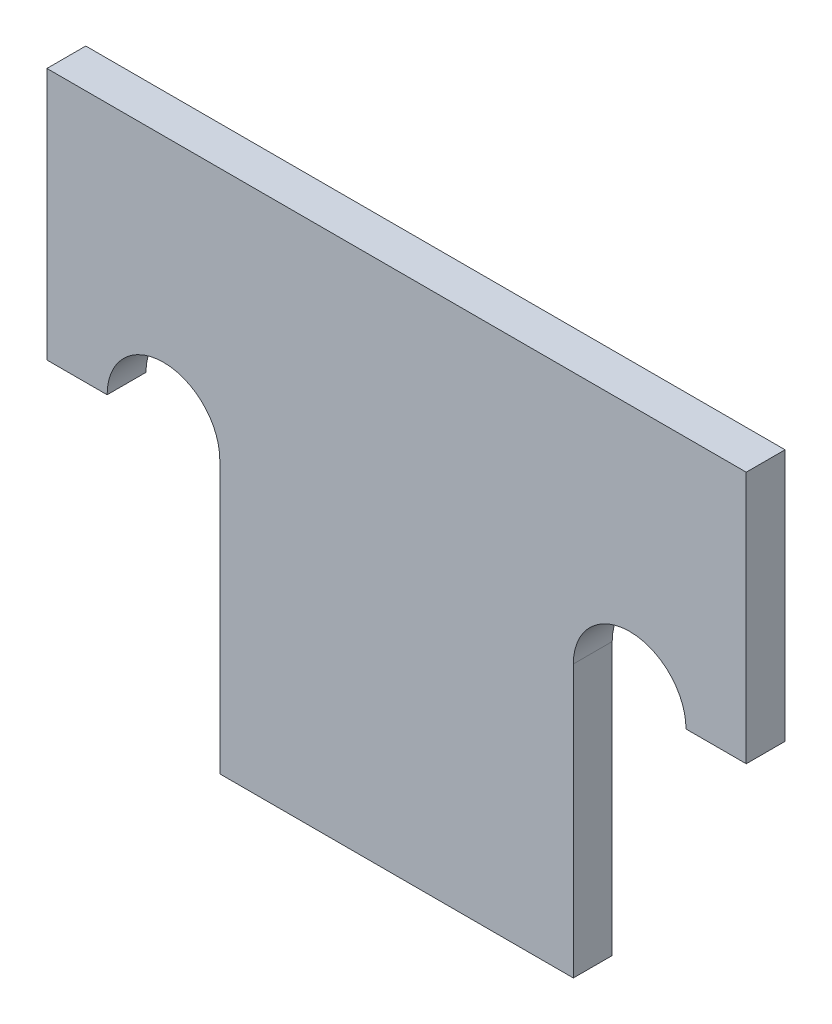
from build123d import *

# Parameters (mm, degrees)
SKETCH1_W           = 45.72
SKETCH1_H           = 34.29
SKETCH1_R           = 3.175
BOSS_EXTRUDE1_DEPTH = 2.54
CUT_EXTRUDE1_DEPTH  = 2.54


with BuildPart() as part:
    # Sketch1 → Boss-Extrude1 (new body)
    with BuildSketch(Plane.XY):
        Rectangle(SKETCH1_W, SKETCH1_H)
        with Locations((15.24, 0.635)):
            Circle(SKETCH1_R, mode=Mode.SUBTRACT)
        with Locations(Location((-15.24, 0.635, 0), (0, 0, 180))):
            Circle(SKETCH1_R, mode=Mode.SUBTRACT)
    extrude(amount=BOSS_EXTRUDE1_DEPTH)

    # Sketch2 → Cut-Extrude1 (cut)
    with BuildSketch(Plane.XY):
        with BuildLine():
            Line((11.557, 0.635), (11.557, -17.145))
            Line((11.557, -17.145), (22.86, -17.145))
            Line((22.86, -17.145), (22.86, 0.635))
            Line((22.86, 0.635), (18.923, 0.635))
            ThreePointArc((18.923, 0.635), (15.24, 4.318), (11.557, 0.635))
        make_face()
        with BuildLine():
            Line((-11.557, 0.635), (-11.557, -17.145))
            Line((-11.557, -17.145), (-22.86, -17.145))
            Line((-22.86, -17.145), (-22.86, 0.635))
            Line((-22.86, 0.635), (-18.923, 0.635))
            ThreePointArc((-18.923, 0.635), (-15.24, 4.318), (-11.557, 0.635))
        make_face()
    extrude(amount=CUT_EXTRUDE1_DEPTH, mode=Mode.SUBTRACT)


solid = part.part
